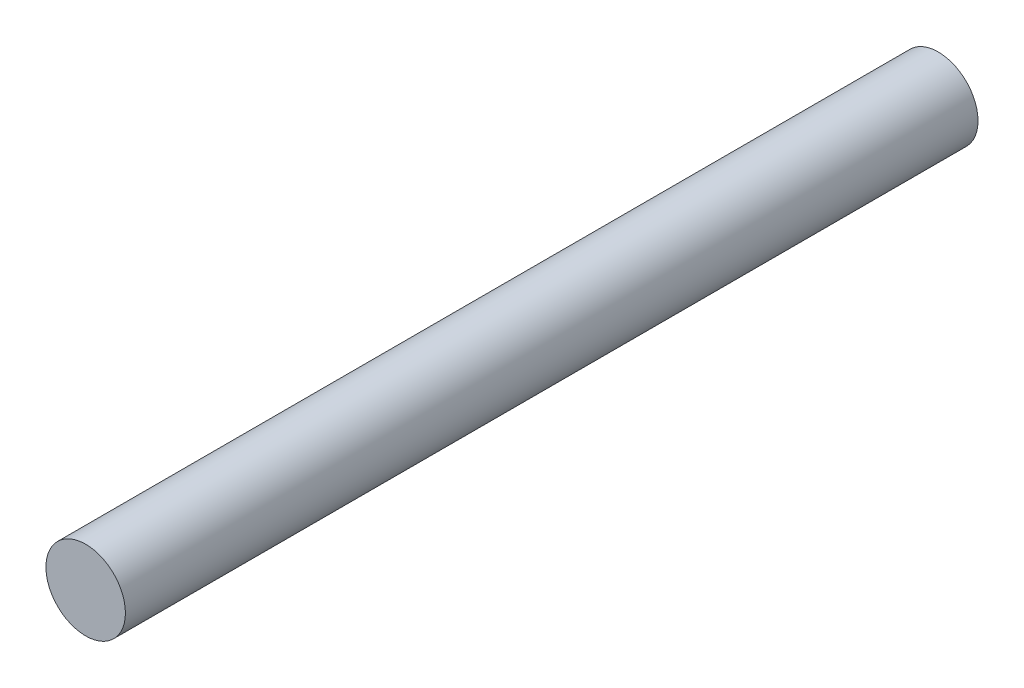
from build123d import *

# Parameters (mm, degrees)
OUTERD_R       = 84.5
BODYTUBE_DEPTH = 1812.8


with BuildPart() as part:
    # outerd → bodytube (new body)
    with BuildSketch(Plane.XY):
        Circle(OUTERD_R)
    extrude(amount=-BODYTUBE_DEPTH)


solid = part.part
